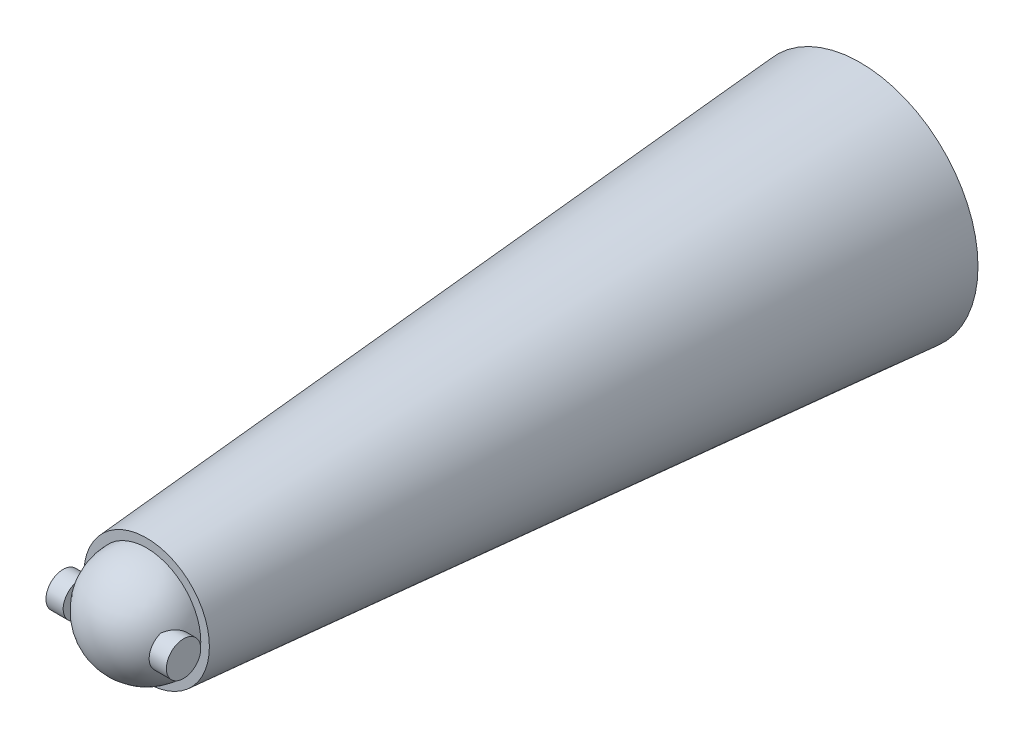
from build123d import *

# Parameters (mm, degrees)
SKETCH1_R           = 68.435
BOSS_EXTRUDE1_DEPTH = 415
BOSS_EXTRUDE1_TAPER = 4.4
SKETCH5_R           = 10
CUT_EXTRUDE1_DEPTH  = 10
CUT_EXTRUDE4_START  = 10
SKETCH4_R           = 10
CUT_EXTRUDE4_DEPTH  = 10
SKETCH9_R           = 10
BOSS_EXTRUDE2_DEPTH = 10
BOSS_EXTRUDE3_START = -10
SKETCH8_R           = 10
BOSS_EXTRUDE3_DEPTH = 10


with BuildPart() as part:
    # Sketch1 → Boss-Extrude1 (new body)
    with BuildSketch(Plane.XY):
        Circle(SKETCH1_R)
    extrude(amount=BOSS_EXTRUDE1_DEPTH, taper=BOSS_EXTRUDE1_TAPER)

    # Sketch2 → Revolve1 (revolve)
    with BuildSketch(Plane.XY.offset(415)):
        with BuildLine():
            Line((0, 31.50249031), (0, -31.50249031))
            ThreePointArc((0, -31.50249031), (-31.50249031, 0), (0, 31.50249031))
        make_face()
    revolve(axis=Axis((0, 31.50249031, 415), (0, -1, 0)))

    # Sketch3 → Cut-Revolve1 (revolve, cut)
    with BuildSketch(Plane(origin=(0, 0, 0), x_dir=(-1, 0, 0), z_dir=(0, 0, -1))):
        with BuildLine():
            Line((0, 63.435), (0, -63.435))
            ThreePointArc((0, -63.435), (-63.435, 0), (0, 63.435))
        make_face()
    revolve(axis=Axis((0, 63.435, 0), (0, -1, 0)), mode=Mode.SUBTRACT)

    # Sketch5 → Cut-Extrude1 (cut)
    with BuildSketch(Plane(origin=(-55, 0, 0), x_dir=(0, 0, -1), z_dir=(1, 0, 0))):
        with Locations((-16.443260801, 0)):
            Circle(SKETCH5_R)
    extrude(amount=-CUT_EXTRUDE1_DEPTH, mode=Mode.SUBTRACT)

    # Sketch4 → Cut-Extrude4 (cut)
    with BuildSketch(Plane(origin=(55, 0, 0), x_dir=(0, 0, -1), z_dir=(1, 0, 0)).offset(CUT_EXTRUDE4_START)):
        with Locations((-16.443260801, 0)):
            Circle(SKETCH4_R)
    extrude(amount=-CUT_EXTRUDE4_DEPTH, mode=Mode.SUBTRACT)

    # Sketch9 → Boss-Extrude2 (add)
    with BuildSketch(Plane(origin=(25, 0, 0), x_dir=(0, 0, -1), z_dir=(1, 0, 0))):
        with Locations(Location((-428.521516395, 0, 0), (0, 0, 108.224680934))):
            Circle(SKETCH9_R)
    extrude(amount=BOSS_EXTRUDE2_DEPTH)

    # Sketch8 → Boss-Extrude3 (add)
    with BuildSketch(Plane(origin=(-25, 0, 0), x_dir=(0, 0, -1), z_dir=(1, 0, 0)).offset(BOSS_EXTRUDE3_START)):
        with Locations(Location((-428.521516395, 0, 0), (0, 0, 108.224680934))):
            Circle(SKETCH8_R)
    extrude(amount=BOSS_EXTRUDE3_DEPTH)


solid = part.part
